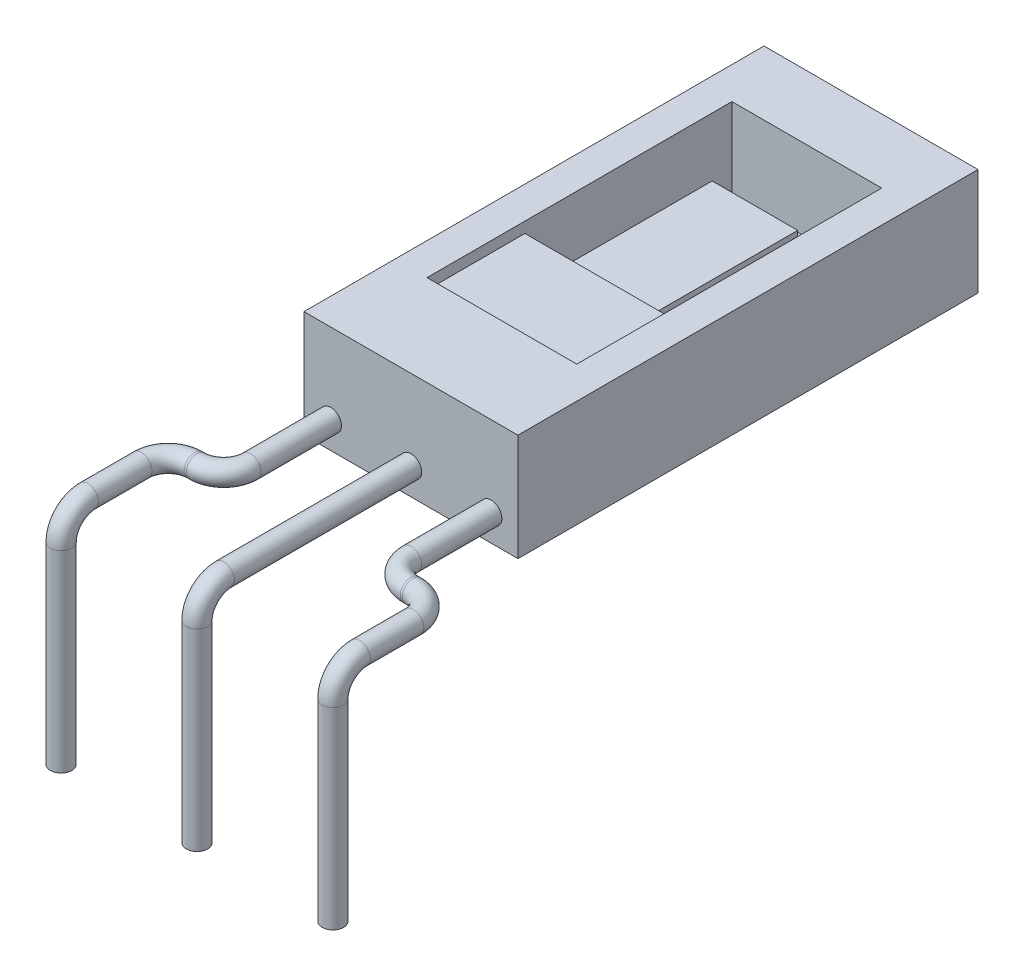
from build123d import *

# Parameters (mm, degrees)
ESQUISSE1_W             = 4
ESQUISSE1_H             = 8.6
EXTRUSION1_DEPTH        = 2
ESQUISSE3_W             = 2.8
ESQUISSE3_H             = 5.7
ENL_V_MAT_EXTRU_1_DEPTH = 1.5
ESQUISSE4_W             = 2.801496874
ESQUISSE4_H             = 1.83
EXTRUSION2_DEPTH        = 1.3
ESQUISSE5_W             = 1.6
ESQUISSE5_H             = 2.9
EXTRUSION3_DEPTH        = 1
ESQUISSE6_R             = 0.2
ESQUISSE8_R             = 0.2


with BuildPart() as part:
    # Esquisse1 → Extrusion1 (new body)
    with BuildSketch(Plane(origin=(0, 0, 0), x_dir=(1, 0, 0), z_dir=(0, 1, 0))):
        with Locations((0, 4.3)):
            Rectangle(ESQUISSE1_W, ESQUISSE1_H)
    extrude(amount=EXTRUSION1_DEPTH)

    # Esquisse3 → Enlèv. mat.-Extru.1 (cut)
    with BuildSketch(Plane(origin=(0, 2, 0), x_dir=(-1, 0, 0), z_dir=(0, 1, 0))):
        with Locations((0, -4.55)):
            Rectangle(ESQUISSE3_W, ESQUISSE3_H)
    extrude(amount=-ENL_V_MAT_EXTRU_1_DEPTH, mode=Mode.SUBTRACT)

    # Esquisse4 → Extrusion2 (add)
    with BuildSketch(Plane(origin=(0, 0.5, 0), x_dir=(-1, 0, 0), z_dir=(0, 1, 0))):
        with Locations((-0.000748437, -2.615)):
            Rectangle(ESQUISSE4_W, ESQUISSE4_H)
    extrude(amount=EXTRUSION2_DEPTH)

    # Esquisse5 → Extrusion3 (add)
    with BuildSketch(Plane(origin=(0, 0.5, 0), x_dir=(-1, 0, 0), z_dir=(0, 1, 0))):
        with Locations((0, -4.98)):
            Rectangle(ESQUISSE5_W, ESQUISSE5_H)
    extrude(amount=EXTRUSION3_DEPTH)

    # Balayage1: sweep along a path in Esquisse7
    with BuildLine(Plane(origin=(0, 0, 0), x_dir=(0, 0, -1), z_dir=(1, 0, 0))) as balayage1_path:
        Line((0, 0.5), (-3.5, 0.5))
        ThreePointArc((-3.5, 0.5), (-3.853553391, 0.353553391), (-4, 0))
        Line((-4, 0), (-4, -3.6))
    # Esquisse6 → Balayage1 (sweep)
    with BuildSketch(Plane.XY):
        with Locations((0, 0.5)):
            Circle(ESQUISSE6_R)
    sweep(path=balayage1_path.line)

    # Balayage2: sweep along a curve in space
    with BuildLine() as balayage2_path:
        Line((-1.5, 0.5, 0), (-1.5, 0.5, 1.5))
        ThreePointArc((-1.5, 0.5, 1.5), (-1.646446609, 0.5, 1.853553391), (-2, 0.5, 2))
        Line((-2, 0.5, 2), (-2.04, 0.5, 2))
        ThreePointArc((-2.04, 0.5, 2), (-2.393553391, 0.5, 2.146446609), (-2.54, 0.5, 2.5))
        Line((-2.54, 0.5, 2.5), (-2.54, 0.5, 3.5))
        ThreePointArc((-2.54, 0.5, 3.5), (-2.54, 0.353553391, 3.853553391), (-2.54, 0, 4))
        Line((-2.54, 0, 4), (-2.54, -3.6, 4))
    # Esquisse8 → Balayage2 (sweep)
    with BuildSketch(Plane.XY):
        with Locations((-1.5, 0.5)):
            Circle(ESQUISSE8_R)
    balayage2 = sweep(path=balayage2_path.line)

    # Symétrie1: Balayage2 across plane
    add(balayage2.mirror(Plane(origin=(0, 0, 0), x_dir=(0, 0, 1), z_dir=(1, 0, 0))))


solid = part.part
